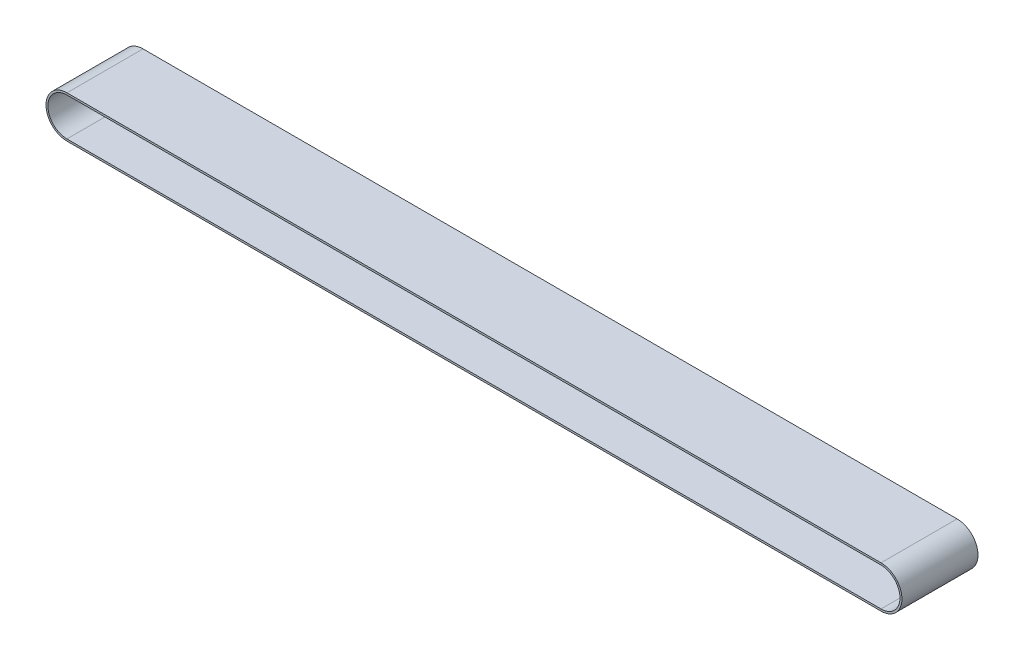
from build123d import *

# Parameters (mm, degrees)
BOSS_EXTRUDE1_DEPTH = 80


with BuildPart() as part:
    # Sketch1 → Boss-Extrude1 (new body)
    with BuildSketch(Plane.XY):
        with BuildLine():
            Line((-383, 22), (473, 22))
            ThreePointArc((473, 22), (495, 0), (473, -22))
            Line((473, -22), (-383, -22))
            ThreePointArc((-383, -22), (-405, 0), (-383, 22))
        make_face()
        with BuildLine():
            Line((-383, 20), (473, 20))
            ThreePointArc((473, 20), (493, 0), (473, -20))
            Line((473, -20), (-383, -20))
            ThreePointArc((-383, -20), (-403, 0), (-383, 20))
        make_face(mode=Mode.SUBTRACT)
    extrude(amount=BOSS_EXTRUDE1_DEPTH)


solid = part.part
